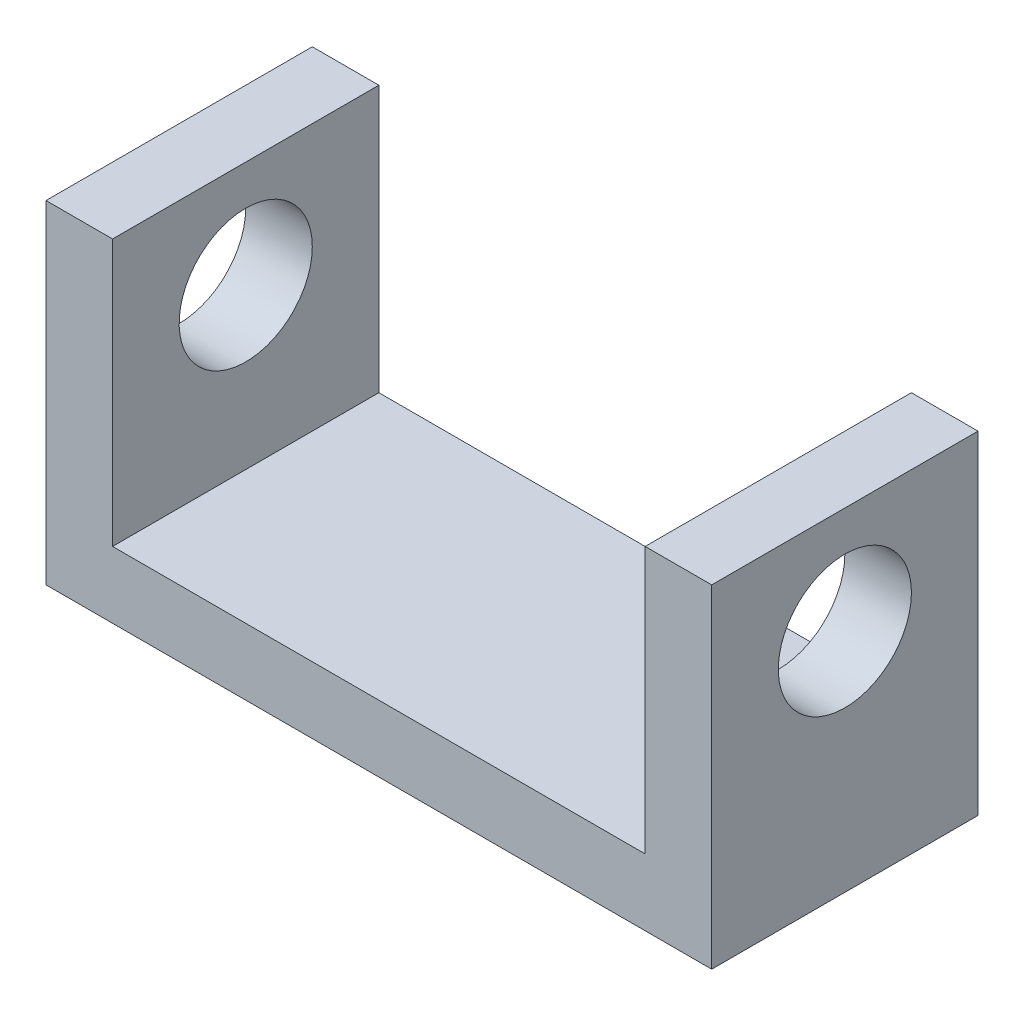
from build123d import *

# Parameters (mm, degrees)
EXTRUDE_THIN1_DEPTH = 12.7
SKETCH2_R           = 3.175
CUT_EXTRUDE1_DEPTH  = 37.477972806


with BuildPart() as part:
    # Sketch1 → Extrude-Thin1 (new body)
    with BuildSketch(Plane.XY):
        Polygon((0, 12.7), (0, 0), (25.4, 0), (25.4, 12.7), (28.575, 12.7), (28.575, -3.175), (-3.175, -3.175), (-3.175, 12.7), align=None)
    extrude(amount=EXTRUDE_THIN1_DEPTH)

    # Sketch2 → Cut-Extrude1 (cut, through all)
    with BuildSketch(Plane(origin=(28.575, 0, 0), x_dir=(0, 0, -1), z_dir=(1, 0, 0))):
        with Locations((-6.35, 7.62)):
            Circle(SKETCH2_R)
    extrude(amount=-CUT_EXTRUDE1_DEPTH, mode=Mode.SUBTRACT)


solid = part.part
